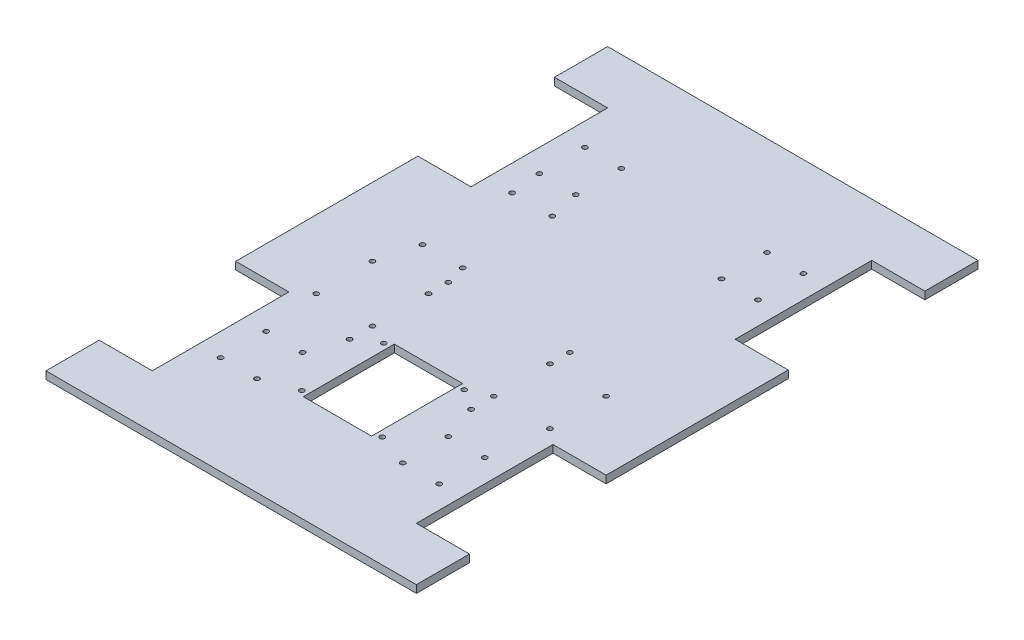
from build123d import *

# Parameters (mm, degrees)
SKETCH_2_W             = 160
SKETCH_2_H             = 250
EXTRUDE_295_DEPTH      = 5
SKETCH_6_R             = 1.6
CUT_EXTRUDE_1846_DEPTH = 297.858552176
SKETCH_7_R             = 1.6
L298N_DEPTH            = 297.858552176
SKETCH_9_R             = 1.6
CUT_EXTRUDE_3042_DEPTH = 10
SKETCH_10_R            = 1.6
CUT_EXTRUDE_3635_DEPTH = 297.858552176
SKETCH_11_W            = 45
SKETCH_11_H            = 60
CUT_EXTRUDE_2560_DEPTH = 297.858552176
SKETCH_12_R            = 1.6
CUT_EXTRUDE_2_DEPTH    = 297.858552176
EXTRUDE_1_DEPTH        = 5
SKETCH_14_W            = 42
SKETCH_14_H            = 120
EXTRUDE_2_DEPTH        = 5
SKETCH_15_W            = 7
SKETCH_15_H            = 90
EXTRUDE_3_DEPTH        = 5


with BuildPart() as part:
    # 草图2 → Extrude 295 (new body)
    with BuildSketch(Plane(origin=(0, 0, 0), x_dir=(1, 0, 0), z_dir=(0, 1, 0))):
        with Locations((80, 125)):
            Rectangle(SKETCH_2_W, SKETCH_2_H)
    extrude(amount=EXTRUDE_295_DEPTH)

    # 草图6 → Cut-Extrude 1846 (cut, through all)
    with BuildSketch(Plane(origin=(0, 5, 0), x_dir=(1, 0, 0), z_dir=(0, 1, 0))):
        with Locations(Location((8, 245, 0), (0, 0, 270))):
            Circle(SKETCH_6_R)
        with Locations(Location((32, 245, 0), (0, 0, 270))):
            Circle(SKETCH_6_R)
        with Locations(Location((8, 215, 0), (0, 0, 270))):
            Circle(SKETCH_6_R)
        with Locations(Location((32, 215, 0), (0, 0, 270))):
            Circle(SKETCH_6_R)
        with Locations(Location((128, 245, 0), (0, 0, 270))):
            Circle(SKETCH_6_R)
        with Locations(Location((152, 245, 0), (0, 0, 270))):
            Circle(SKETCH_6_R)
        with Locations(Location((128, 215, 0), (0, 0, 270))):
            Circle(SKETCH_6_R)
        with Locations(Location((152, 215, 0), (0, 0, 270))):
            Circle(SKETCH_6_R)
        with Locations(Location((32, 35, 0), (0, 0, 270))):
            Circle(SKETCH_6_R)
        with Locations(Location((8, 35, 0), (0, 0, 270))):
            Circle(SKETCH_6_R)
        with Locations(Location((8, 5, 0), (0, 0, 270))):
            Circle(SKETCH_6_R)
        with Locations(Location((32, 5, 0), (0, 0, 270))):
            Circle(SKETCH_6_R)
        with Locations(Location((128, 35, 0), (0, 0, 270))):
            Circle(SKETCH_6_R)
        with Locations(Location((152, 35, 0), (0, 0, 270))):
            Circle(SKETCH_6_R)
        with Locations(Location((128, 5, 0), (0, 0, 270))):
            Circle(SKETCH_6_R)
        with Locations(Location((152, 5, 0), (0, 0, 270))):
            Circle(SKETCH_6_R)
    extrude(amount=-CUT_EXTRUDE_1846_DEPTH, mode=Mode.SUBTRACT)

    # 草图7 → L298N固定 (cut, through all)
    with BuildSketch(Plane(origin=(0, 5, 0), x_dir=(1, 0, 0), z_dir=(0, 1, 0))):
        with Locations(Location((3, 110, 0), (0, 0, 270))):
            Circle(SKETCH_7_R)
        with Locations(Location((40, 73, 0), (0, 0, 270))):
            Circle(SKETCH_7_R)
        with Locations(Location((3, 73, 0), (0, 0, 270))):
            Circle(SKETCH_7_R)
        with Locations(Location((40, 110, 0), (0, 0, 270))):
            Circle(SKETCH_7_R)
        with Locations(Location((120, 110, 0), (0, 0, 270))):
            Circle(SKETCH_7_R)
        with Locations(Location((157, 73, 0), (0, 0, 270))):
            Circle(SKETCH_7_R)
        with Locations(Location((120, 73, 0), (0, 0, 270))):
            Circle(SKETCH_7_R)
        with Locations(Location((157, 110, 0), (0, 0, 270))):
            Circle(SKETCH_7_R)
    extrude(amount=-L298N_DEPTH, mode=Mode.SUBTRACT)

    # 草图9 → Cut-Extrude 3042 (cut)
    with BuildSketch(Plane.XZ):
        with Locations(Location((36.5, -195, 0), (0, 0, 270))):
            Circle(SKETCH_9_R)
        with Locations(Location((10, -136, 0), (0, 0, 270))):
            Circle(SKETCH_9_R)
        with Locations(Location((10, -195, 0), (0, 0, 270))):
            Circle(SKETCH_9_R)
        with Locations(Location((36.5, -136, 0), (0, 0, 270))):
            Circle(SKETCH_9_R)
    extrude(amount=-CUT_EXTRUDE_3042_DEPTH, mode=Mode.SUBTRACT)

    # 草图10 → Cut-Extrude 3635 (cut, through all)
    with BuildSketch(Plane.XZ):
        with Locations(Location((40, -123, 0), (0, 0, 270))):
            Circle(SKETCH_10_R)
        with Locations(Location((120, -123, 0), (0, 0, 270))):
            Circle(SKETCH_10_R)
        with Locations(Location((40, -58, 0), (0, 0, 270))):
            Circle(SKETCH_10_R)
        with Locations(Location((120, -58, 0), (0, 0, 270))):
            Circle(SKETCH_10_R)
    extrude(amount=-CUT_EXTRUDE_3635_DEPTH, mode=Mode.SUBTRACT)

    # 草图11 → Cut-Extrude 2560 (cut, through all)
    with BuildSketch(Plane(origin=(0, 5, 0), x_dir=(1, 0, 0), z_dir=(0, 1, 0))):
        with Locations((80, 40)):
            Rectangle(SKETCH_11_W, SKETCH_11_H)
    extrude(amount=-CUT_EXTRUDE_2560_DEPTH, mode=Mode.SUBTRACT)

    # 草图12 → 切除-拉伸2 (cut, through all)
    with BuildSketch(Plane(origin=(0, 5, 0), x_dir=(1, 0, 0), z_dir=(0, 1, 0))):
        with Locations(Location((106.5, 13, 0), (0, 0, 270))):
            Circle(SKETCH_12_R)
        with Locations(Location((53.5, 67, 0), (0, 0, 270))):
            Circle(SKETCH_12_R)
        with Locations(Location((106.5, 67, 0), (0, 0, 270))):
            Circle(SKETCH_12_R)
        with Locations(Location((53.5, 13, 0), (0, 0, 270))):
            Circle(SKETCH_12_R)
    extrude(amount=-CUT_EXTRUDE_2_DEPTH, mode=Mode.SUBTRACT)

    # 草图13 → 凸台-拉伸1 (add)
    with BuildSketch(Plane(origin=(0, 5, 0), x_dir=(1, 0, 0), z_dir=(0, 1, 0))):
        Polygon((202, -60), (-42, -60), (-42, -25), (0, -25), (0, 0), (160, 0), (160, -25), (202, -25), align=None)
        Polygon((202, 275), (160, 275), (160, 250), (0, 250), (0, 275), (-42, 275), (-42, 310), (202, 310), align=None)
    extrude(amount=-EXTRUDE_1_DEPTH)

    # 草图14 → 凸台-拉伸2 (add)
    with BuildSketch(Plane(origin=(0, 5, 0), x_dir=(1, 0, 0), z_dir=(0, 1, 0))):
        with Locations((181, 125)):
            Rectangle(SKETCH_14_W, SKETCH_14_H)
        with Locations((-21, 125)):
            Rectangle(SKETCH_14_W, SKETCH_14_H)
    extrude(amount=-EXTRUDE_2_DEPTH)

    # 草图15 → 凸台-拉伸3 (add)
    with BuildSketch(Plane(origin=(0, 5, 0), x_dir=(1, 0, 0), z_dir=(0, 1, 0))):
        with Locations((163.5, 20)):
            Rectangle(SKETCH_15_W, SKETCH_15_H)
        with Locations((163.5, 230)):
            Rectangle(SKETCH_15_W, SKETCH_15_H)
        with Locations((-3.5, 20)):
            Rectangle(SKETCH_15_W, SKETCH_15_H)
        with Locations((-3.5, 230)):
            Rectangle(SKETCH_15_W, SKETCH_15_H)
    extrude(amount=-EXTRUDE_3_DEPTH)


solid = part.part
